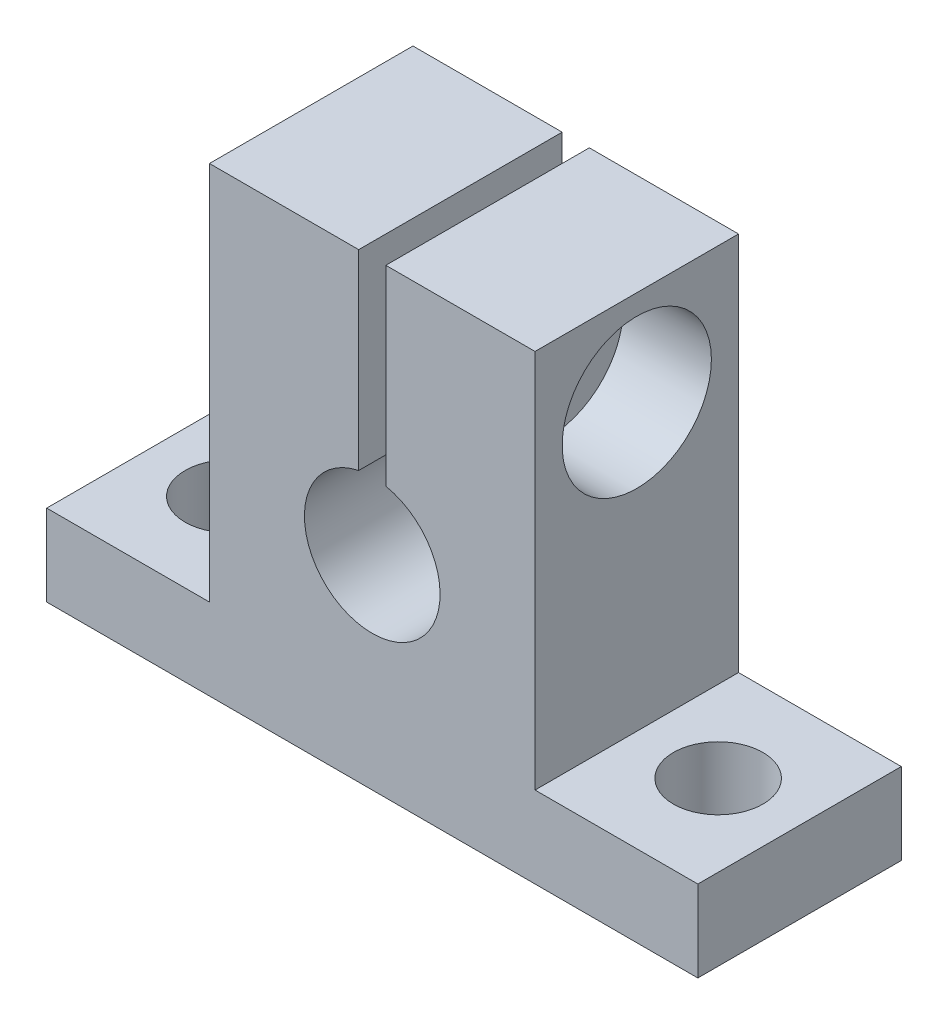
from build123d import *

# Parameters (mm, degrees)
BOSS_EXTRUDE1_DEPTH                          = 7.5
SKETCH2_R                                    = 5
CUT_EXTRUDE1_DEPTH                           = 45.237992721
SKETCH3_W                                    = 2
SKETCH3_H                                    = 19
CUT_EXTRUDE2_DEPTH                           = 45.237992721
CBORE_FOR_SOCKET_HEAD_CAP_SCREW1_D           = 6.6
CBORE_FOR_SOCKET_HEAD_CAP_SCREW1_DEPTH       = 11
CBORE_FOR_SOCKET_HEAD_CAP_SCREW1_CBORE_D     = 11
CBORE_FOR_SOCKET_HEAD_CAP_SCREW1_CBORE_DEPTH = 6.5
TAPPED_HOLE1_D                               = 5
DIAMETER_HOLE1_D                             = 6.6


with BuildPart() as part:
    # Sketch1 → Boss-Extrude1 (new, symmetric)
    with BuildSketch(Plane.XY):
        Polygon((-24, 0), (24, 0), (24, 6), (12, 6), (12, 34), (-12, 34), (-12, 6), (-24, 6), align=None)
    extrude(amount=BOSS_EXTRUDE1_DEPTH, both=True)

    # Sketch2 → Cut-Extrude1 (cut, through all)
    with BuildSketch(Plane.XY.offset(7.5)):
        with Locations((0, 15)):
            Circle(SKETCH2_R)
    extrude(amount=-CUT_EXTRUDE1_DEPTH, mode=Mode.SUBTRACT)

    # Sketch3 → Cut-Extrude2 (cut, through all)
    with BuildSketch(Plane.XY.offset(7.5)):
        with Locations((0, 24.5)):
            Rectangle(SKETCH3_W, SKETCH3_H)
    extrude(amount=-CUT_EXTRUDE2_DEPTH, mode=Mode.SUBTRACT)

    # CBORE for Socket Head Cap Screw1
    with Locations(Plane(origin=(12, 0, 0), x_dir=(0, 0, -1), z_dir=(1, 0, 0))):
        with Locations((0, 27)):
            CounterBoreHole(CBORE_FOR_SOCKET_HEAD_CAP_SCREW1_D / 2, CBORE_FOR_SOCKET_HEAD_CAP_SCREW1_CBORE_D / 2, CBORE_FOR_SOCKET_HEAD_CAP_SCREW1_CBORE_DEPTH, depth=CBORE_FOR_SOCKET_HEAD_CAP_SCREW1_DEPTH)

    # Tapped Hole1 (through all)
    with Locations(Plane(origin=(-1, 0, 0), x_dir=(0, 0, -1), z_dir=(1, 0, 0))):
        with Locations((0, 27)):
            Hole(TAPPED_HOLE1_D / 2)

    # Diameter Hole1 (through all)
    with Locations(Plane(origin=(0, 6, 0), x_dir=(1, 0, 0), z_dir=(0, 1, 0))):
        with Locations((18, 0), (-18, 0)):
            Hole(DIAMETER_HOLE1_D / 2)


solid = part.part
